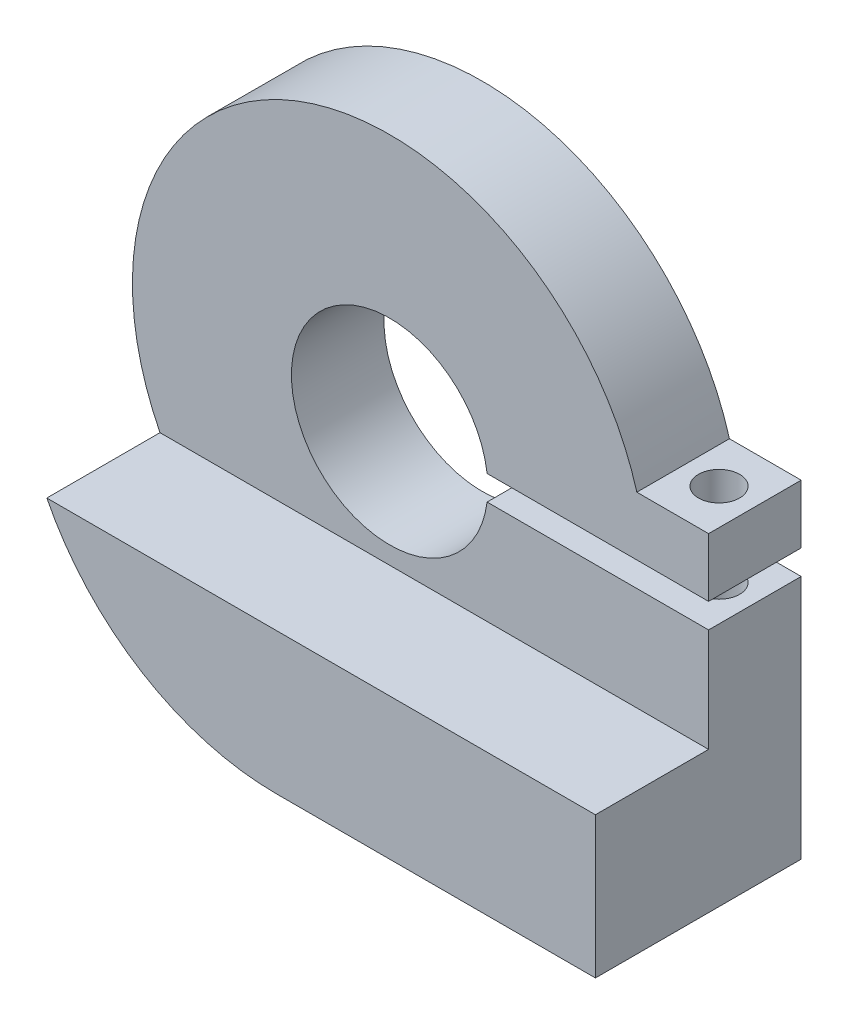
from build123d import *
from build123d.topology import SkipClean

# Parameters (mm, degrees)
BOSS_EXTRUDE1_DEPTH = 4.5
BOSS_EXTRUDE2_DEPTH = 5.5
SKETCH4_R           = 1
CUT_EXTRUDE1_DEPTH  = 5.5


with BuildPart() as part:
    # Sketch1 → Boss-Extrude1 (new body)
    with BuildSketch(Plane.XY):
        with BuildLine():
            Line((0, -12.5), (15.5, -12.5))
            Line((15.5, -12.5), (15.5, -0.6))
            Line((15.5, -0.6), (4.735951007, -0.6))
            ThreePointArc((4.735951007, -0.6), (-4.77380686, 0), (4.735951007, 0.6))
            Line((4.735951007, 0.6), (15.5, 0.6))
            Line((15.5, 0.6), (15.5, 3.452502188))
            Line((15.5, 3.452502188), (12.013751647, 3.452502188))
            ThreePointArc((12.013751647, 3.452502188), (-9.985145901, 7.519764712), (0, -12.5))
        make_face()
    extrude(amount=BOSS_EXTRUDE1_DEPTH)

    # Sketch2 → Boss-Extrude2 (add)
    with SkipClean():  # the faces are left unmerged after this step: merging them gives an invalid solid
        with BuildSketch(Plane.XY.offset(4.5)):
            with BuildLine():
                Line((15.5, -12.5), (0, -12.5))
                ThreePointArc((0, -12.5), (-6.553255279, -10.644474869), (-11.160953781, -5.628775239))
                Line((-11.160953781, -5.628775239), (15.5, -5.628775239))
                Line((15.5, -5.628775239), (15.5, -12.5))
            make_face()
        extrude(amount=BOSS_EXTRUDE2_DEPTH)

    # Sketch4 → Cut-Extrude1 (cut)
    with SkipClean():  # the faces are left unmerged after this step: merging them gives an invalid solid
        with BuildSketch(Plane(origin=(0, 3.452502188, 0), x_dir=(1, 0, 0), z_dir=(0, 1, 0))):
            with Locations(Location((13.756875824, -2.25, 0), (0, 0, 180))):
                Circle(SKETCH4_R)
        extrude(amount=-CUT_EXTRUDE1_DEPTH, mode=Mode.SUBTRACT)


solid = part.part
